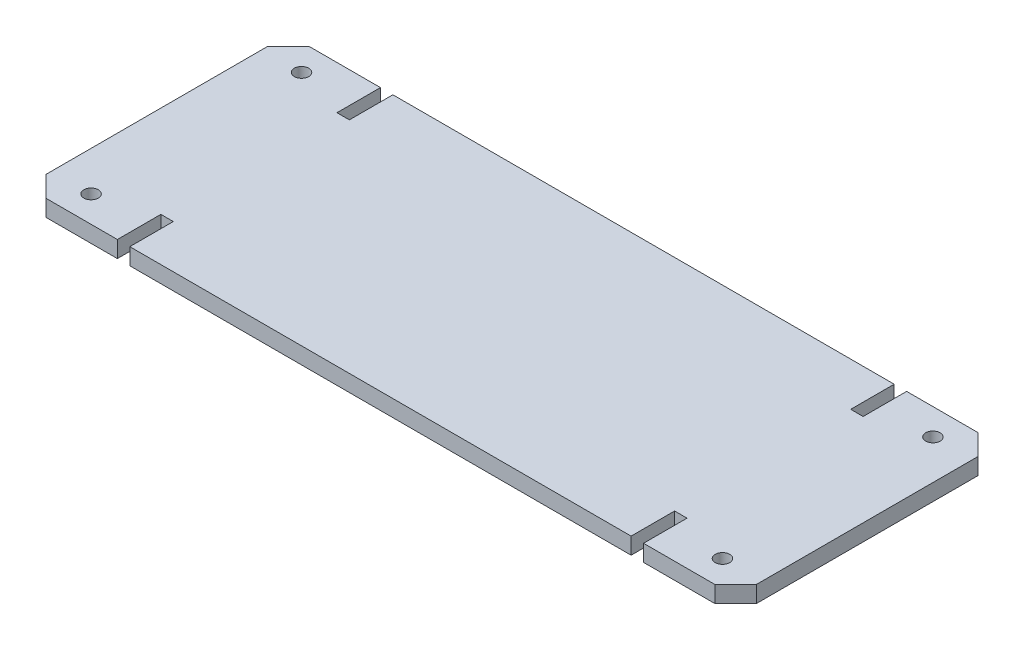
from build123d import *

# Parameters (mm, degrees)
SKETCH1_W           = 171.45
SKETCH1_H           = 63.5
SKETCH1_R           = 1.75
BOSS_EXTRUDE1_DEPTH = 4
CHAMFER1_SIZE       = 5
SKETCH3_W           = 3
SKETCH3_H           = 10.5
CUT_EXTRUDE2_DEPTH  = 4


with BuildPart() as part:
    # Sketch1 → Boss-Extrude1 (new body)
    with BuildSketch(Plane(origin=(0, 0, 0), x_dir=(1, 0, 0), z_dir=(0, 1, 0))):
        Rectangle(SKETCH1_W, SKETCH1_H)
        with Locations(Location((-76.2, 25.4, 0), (0, 0, 270))):
            Circle(SKETCH1_R, mode=Mode.SUBTRACT)
        with Locations(Location((-76.2, -25.4, 0), (0, 0, 270))):
            Circle(SKETCH1_R, mode=Mode.SUBTRACT)
        with Locations(Location((76.2, 25.4, 0), (0, 0, 270))):
            Circle(SKETCH1_R, mode=Mode.SUBTRACT)
        with Locations(Location((76.2, -25.4, 0), (0, 0, 270))):
            Circle(SKETCH1_R, mode=Mode.SUBTRACT)
    extrude(amount=BOSS_EXTRUDE1_DEPTH)

    # Chamfer1
    chamfer1_edges = [part.edges().sort_by_distance(p)[0] for p in [
        (85.725, 2, 31.75),
        (-85.725, 2, 31.75),
        (-85.725, 2, -31.75),
        (85.725, 2, -31.75),
    ]]
    chamfer(chamfer1_edges, length=CHAMFER1_SIZE)

    # Sketch3 → Cut-Extrude2 (cut)
    with BuildSketch(Plane(origin=(0, 4, 0), x_dir=(1, 0, 0), z_dir=(0, 1, 0))):
        with Locations((62, -26.5)):
            Rectangle(SKETCH3_W, SKETCH3_H)
        with Locations((62, 26.5)):
            Rectangle(SKETCH3_W, SKETCH3_H)
        with Locations((-62, -26.5)):
            Rectangle(SKETCH3_W, SKETCH3_H)
        with Locations((-62, 26.5)):
            Rectangle(SKETCH3_W, SKETCH3_H)
    extrude(amount=-CUT_EXTRUDE2_DEPTH, mode=Mode.SUBTRACT)


solid = part.part
